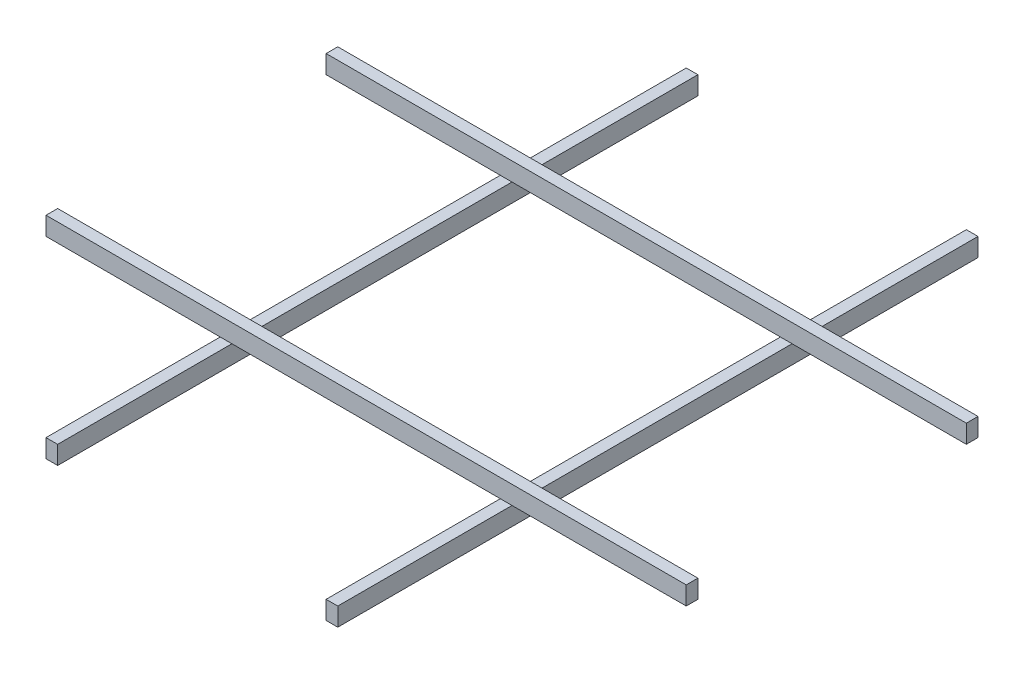
from build123d import *

# Parameters (mm, degrees)
SKETCH1_W              = 88.9
SKETCH1_H              = 139.7
PROFILES_4X6_1_DEPTH   = 4876.8
SKETCH1_ON_SEGMENT_2_W = 88.9
SKETCH1_ON_SEGMENT_2_H = 139.7
PROFILES_4X6_1_2_DEPTH = 4876.8
SKETCH1_ON_SEGMENT_3_W = 88.9
SKETCH1_ON_SEGMENT_3_H = 139.7
PROFILES_4X6_1_3_DEPTH = 4876.8
SKETCH1_ON_SEGMENT_4_W = 88.9
SKETCH1_ON_SEGMENT_4_H = 139.7
PROFILES_4X6_1_4_DEPTH = 4876.8


with BuildPart() as part:
    # Sketch1 → Profiles 4X6(1) (new body)
    with BuildSketch(Plane(origin=(1066.8, 0, 0), x_dir=(-1, 0, 0), z_dir=(0, 0, -1))):
        Rectangle(SKETCH1_W, SKETCH1_H)
    extrude(amount=PROFILES_4X6_1_DEPTH)


with BuildPart() as body_2:
    # Sketch1 on segment 2 (carried to segment 2) → Profiles 4X6_1 2 (new body)
    with BuildSketch(Plane(origin=(3200.4, 0, 0), x_dir=(-1, 0, 0), z_dir=(0, 0, -1))):
        Rectangle(SKETCH1_ON_SEGMENT_2_W, SKETCH1_ON_SEGMENT_2_H)
    extrude(amount=PROFILES_4X6_1_2_DEPTH)


with BuildPart() as body_3:
    # Sketch1 on segment 3 (carried to segment 3) → Profiles 4X6_1 3 (new body)
    with BuildSketch(Plane(origin=(-304.8, 139.7, -3505.2), x_dir=(0, 0, -1), z_dir=(1, 0, 0))):
        Rectangle(SKETCH1_ON_SEGMENT_3_W, SKETCH1_ON_SEGMENT_3_H)
    extrude(amount=PROFILES_4X6_1_3_DEPTH)


with BuildPart() as body_4:
    # Sketch1 on segment 4 (carried to segment 4) → Profiles 4X6_1 4 (new body)
    with BuildSketch(Plane(origin=(4572, 139.7, -1371.6), x_dir=(0, 0, 1), z_dir=(-1, 0, 0))):
        Rectangle(SKETCH1_ON_SEGMENT_4_W, SKETCH1_ON_SEGMENT_4_H)
    extrude(amount=PROFILES_4X6_1_4_DEPTH)


solid = Compound([part.part, body_2.part, body_3.part, body_4.part])
